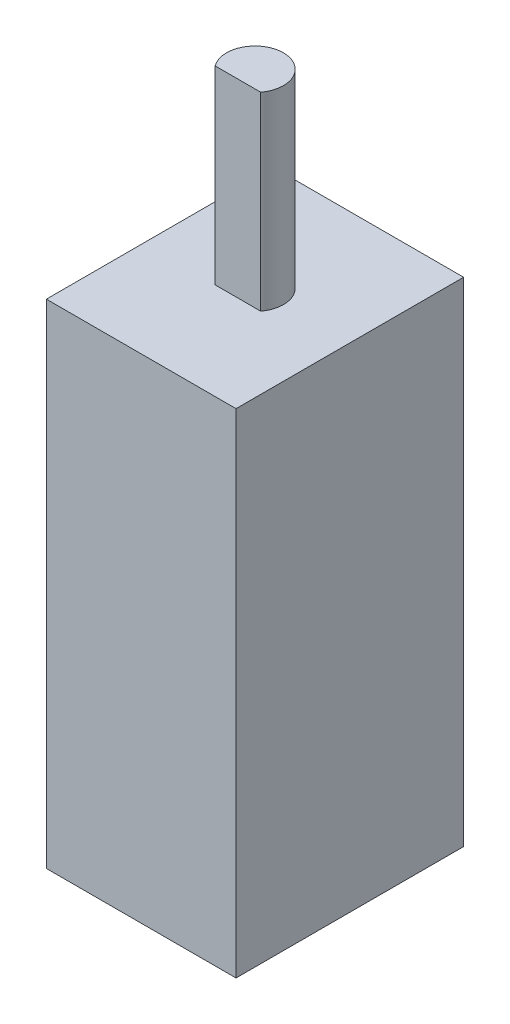
from build123d import *

# Parameters (mm, degrees)
SKETCH2_W           = 10
SKETCH2_H           = 12
BOSS_EXTRUDE1_DEPTH = 26
BOSS_EXTRUDE2_DEPTH = 10


with BuildPart() as part:
    # Sketch2 → Boss-Extrude1 (new body)
    with BuildSketch(Plane(origin=(0, 0, 0), x_dir=(1, 0, 0), z_dir=(0, 1, 0))):
        Rectangle(SKETCH2_W, SKETCH2_H)
    extrude(amount=BOSS_EXTRUDE1_DEPTH)

    # Sketch3 → Boss-Extrude2 (add)
    with BuildSketch(Plane(origin=(0, 26, 0), x_dir=(1, 0, 0), z_dir=(0, 1, 0))):
        with BuildLine():
            ThreePointArc((1.5, 0), (1.060660172, 1.060660172), (0, 1.5))
            Line((0, 1.5), (0, -0.9))
            Line((0, -0.9), (1.2, -0.9))
            ThreePointArc((1.2, -0.9), (1.423024947, -0.474341649), (1.5, 0))
        make_face()
        with BuildLine():
            Line((0, -0.9), (0, 1.5))
            ThreePointArc((0, 1.5), (-1.341640786, 0.670820393), (-1.2, -0.9))
            Line((-1.2, -0.9), (0, -0.9))
        make_face()
    extrude(amount=BOSS_EXTRUDE2_DEPTH)


solid = part.part
